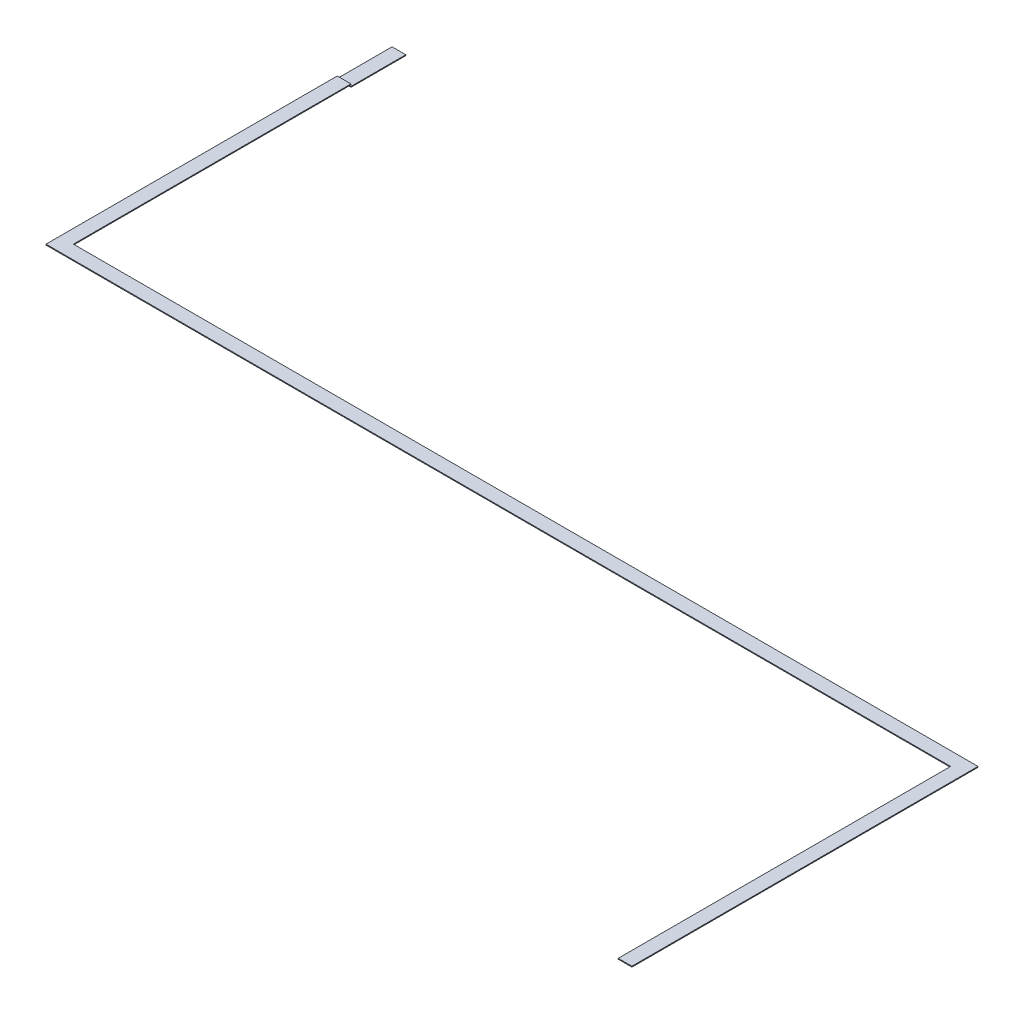
from build123d import *

# Parameters (mm, degrees)
SKETCH4_W           = 50.8
SKETCH4_H           = 1231.9
SKETCH4_H_2         = 50.8
BOSS_EXTRUDE4_DEPTH = 3.175
SKETCH7_W           = 50.8
SKETCH7_H           = 203.2
CUT_EXTRUDE1_DEPTH  = 4232.750961555
SKETCH8_W           = 50.8
SKETCH8_H           = 203.2
BOSS_EXTRUDE5_DEPTH = 3.175


with BuildPart() as part:
    # Sketch4 → Boss-Extrude4 (new body)
    with BuildSketch(Plane(origin=(0, 0, 0), x_dir=(1, 0, 0), z_dir=(0, 1, 0))):
        with Locations((25.4, -615.95)):
            Rectangle(SKETCH4_W, SKETCH4_H)
        Polygon((3352.8, -1231.9), (50.8, -1231.9), (0, -1231.9), (0, -1282.7), (3352.8, -1282.7), align=None)
        with Locations((3378.2, -1257.3)):
            Rectangle(SKETCH4_W, SKETCH4_H_2)
        with Locations((3378.2, -1898.65)):
            Rectangle(SKETCH4_W, SKETCH4_H)
    extrude(amount=-BOSS_EXTRUDE4_DEPTH)

    # Sketch7 → Cut-Extrude1 (cut, through all)
    with BuildSketch(Plane.XZ.offset(3.175)):
        with Locations((25.4, 101.6)):
            Rectangle(SKETCH7_W, SKETCH7_H)
    extrude(amount=-CUT_EXTRUDE1_DEPTH, mode=Mode.SUBTRACT)


with BuildPart() as body_2:
    # Sketch8 → Boss-Extrude5 (new body)
    with BuildSketch(Plane(origin=(0, -7.9375, 0), x_dir=(-1, 0, 0), z_dir=(0, -1, 0))):
        with Locations((-25.4, -101.6)):
            Rectangle(SKETCH8_W, SKETCH8_H)
    extrude(amount=BOSS_EXTRUDE5_DEPTH)


solid = Compound([part.part, body_2.part])
